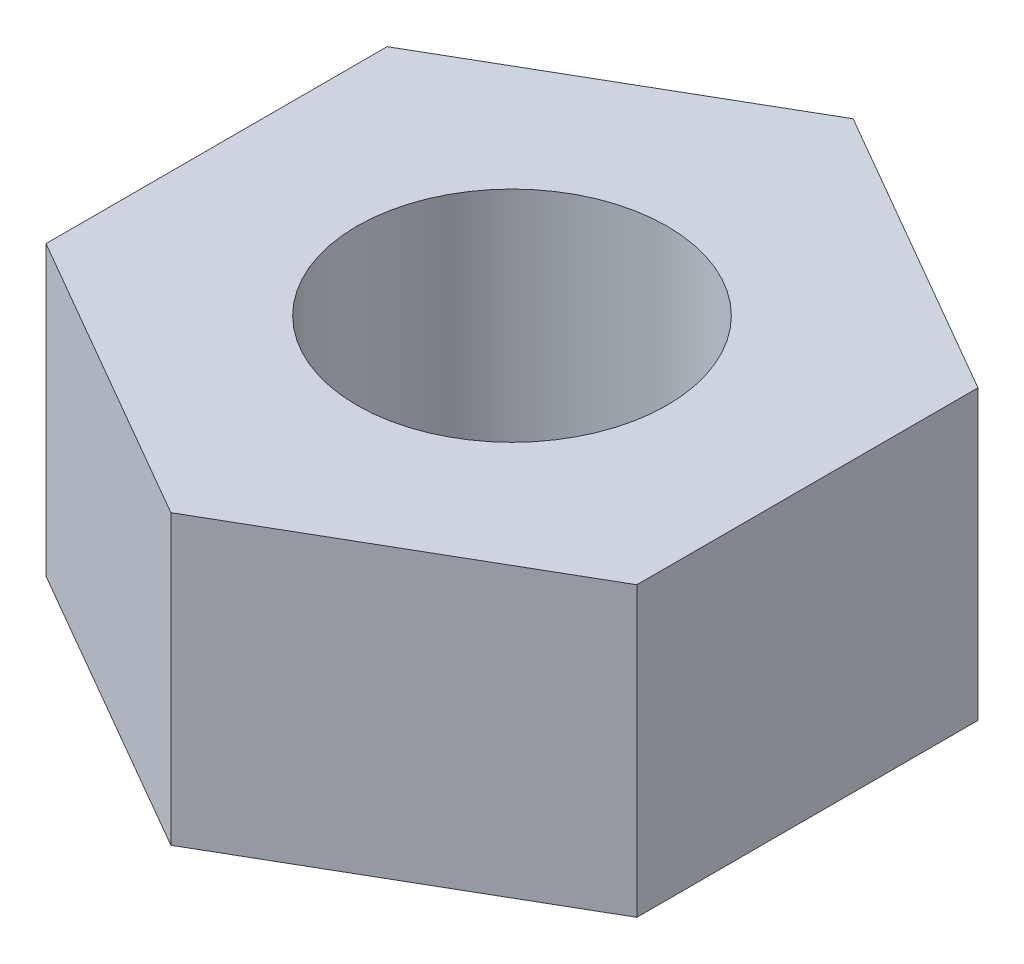
from build123d import *

# Parameters (mm, degrees)
EXTRUDE_1_DEPTH    = 3.9
HOLE_WIZARD_M5_1_D = 4.2


with BuildPart() as part:
    # 草图1 → 凸台-拉伸1 (new body)
    with BuildSketch(Plane(origin=(0, 0, 0), x_dir=(1, 0, 0), z_dir=(0, 1, 0))):
        Polygon((4, -2.309401077), (4, 2.309401077), (0, 4.618802154), (-4, 2.309401077), (-4, -2.309401077), (0, -4.618802154), align=None)
    extrude(amount=EXTRUDE_1_DEPTH)

    # M5 螺纹孔1 (through all)
    with Locations(Plane(origin=(0, 0, 0), x_dir=(0, 0, -1), z_dir=(0, -1, 0))):
        with Locations((0, 0)):
            Hole(HOLE_WIZARD_M5_1_D / 2)


solid = part.part
